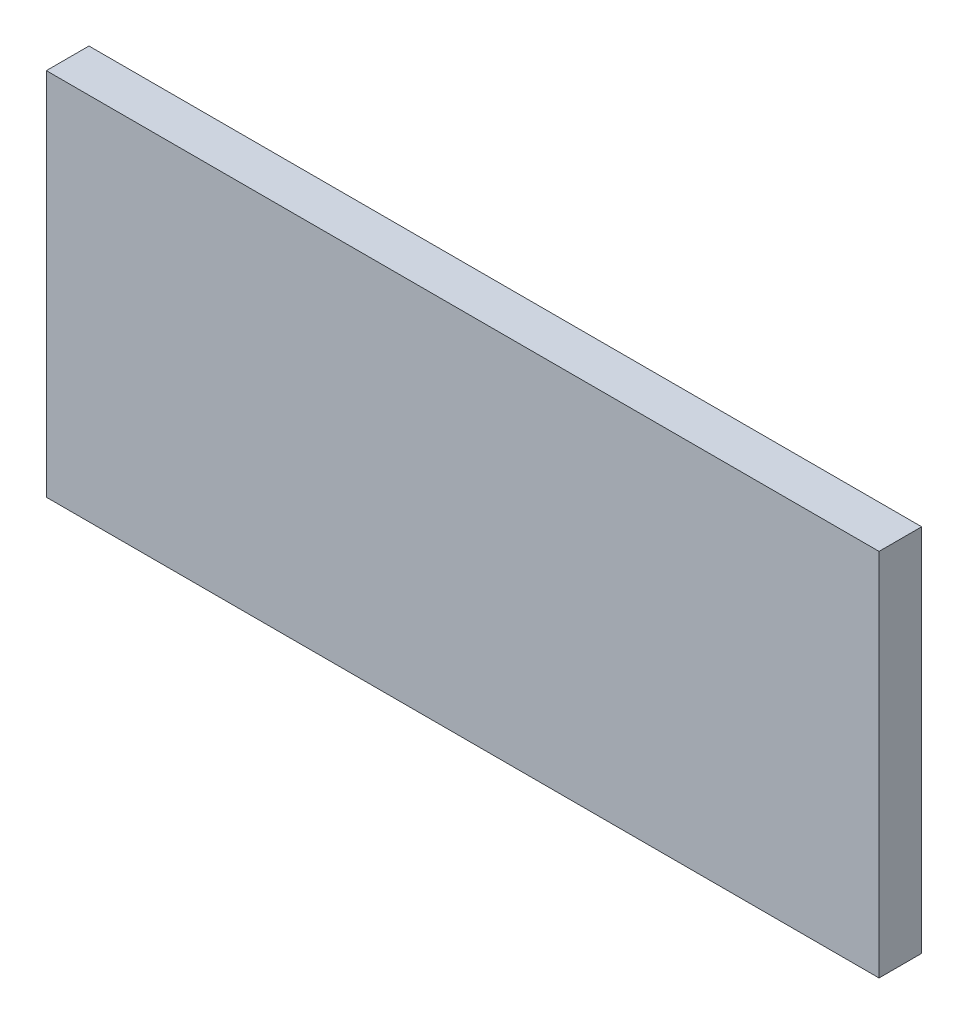
from build123d import *

# Parameters (mm, degrees)
SZKIC1_W                    = 293
SZKIC1_H                    = 15
DODANIE_WYCI_GNI_CIE1_DEPTH = 130


with BuildPart() as part:
    # Szkic1 → Dodanie-wyciągnięcie1 (new body)
    with BuildSketch(Plane(origin=(0, 0, 0), x_dir=(1, 0, 0), z_dir=(0, 1, 0))):
        Rectangle(SZKIC1_W, SZKIC1_H)
    extrude(amount=DODANIE_WYCI_GNI_CIE1_DEPTH)


solid = part.part
